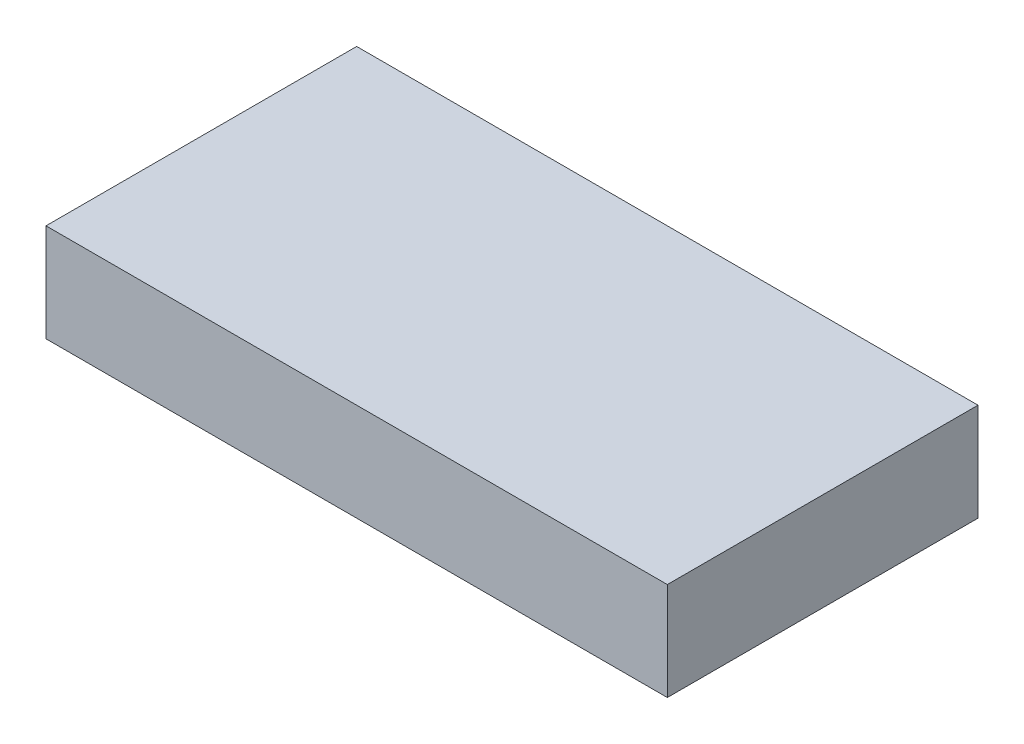
from build123d import *

# Parameters (mm, degrees)
SKETCH1_W           = 40
SKETCH1_H           = 20
BOSS_EXTRUDE1_DEPTH = 6.3


with BuildPart() as part:
    # Sketch1 → Boss-Extrude1 (new body)
    with BuildSketch(Plane(origin=(0, 0, 0), x_dir=(1, 0, 0), z_dir=(0, 1, 0))):
        with Locations((20, 10)):
            Rectangle(SKETCH1_W, SKETCH1_H)
    extrude(amount=BOSS_EXTRUDE1_DEPTH)


solid = part.part
